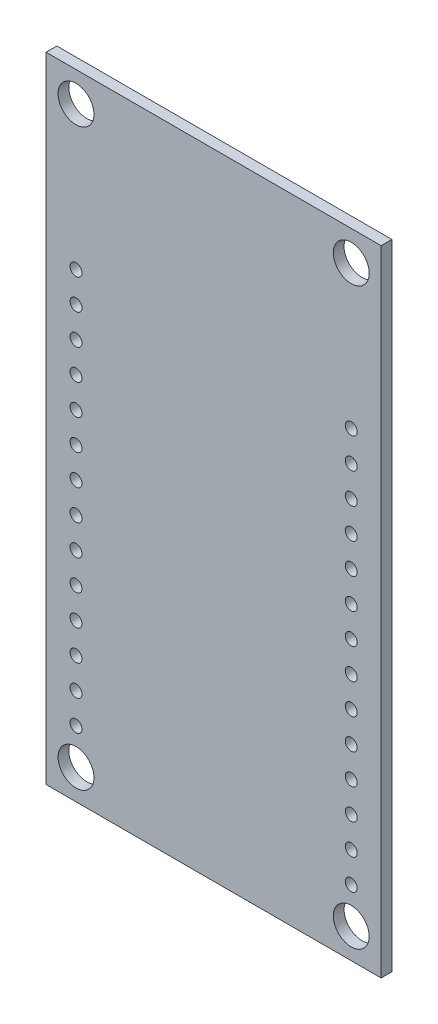
from build123d import *

# Parameters (mm, degrees)
ESBO_O1_W                = 28
ESBO_O1_H                = 53
RESSALTO_EXTRUS_O1_DEPTH = 0.45
CORTE_EXTRUS_O1_REACH    = 31.984
ESBO_O4_R                = 1.5
CORTE_EXTRUS_O2_REACH    = 31.984
ESBO_O5_R                = 0.5
PADR_O_LINEAR1_COUNT     = 14
PADR_O_LINEAR1_PITCH     = 2.54


with BuildPart() as part:
    # Esboço1 → Ressalto-extrusão1 (new, symmetric)
    with BuildSketch(Plane.XY):
        Rectangle(ESBO_O1_W, ESBO_O1_H)
    extrude(amount=RESSALTO_EXTRUS_O1_DEPTH, both=True)

    # Esboço4 → Corte-extrusão1 (cut, up to next)
    with BuildSketch(Plane.XY.offset(0.45), mode=Mode.PRIVATE) as corte_extrus_o1_sk1:
        with Locations((-11.5, -24)):
            Circle(ESBO_O4_R)
    corte_extrus_o1_tool1 = extrude(corte_extrus_o1_sk1.sketch, amount=-CORTE_EXTRUS_O1_REACH, mode=Mode.PRIVATE) & part.part
    # Esboço4 → Corte-extrusão1 (cut, up to next)
    with BuildSketch(Plane.XY.offset(0.45), mode=Mode.PRIVATE) as corte_extrus_o1_sk2:
        with Locations((11.5, -24)):
            Circle(ESBO_O4_R)
    corte_extrus_o1_tool2 = extrude(corte_extrus_o1_sk2.sketch, amount=-CORTE_EXTRUS_O1_REACH, mode=Mode.PRIVATE) & part.part
    # Esboço4 → Corte-extrusão1 (cut, up to next)
    with BuildSketch(Plane.XY.offset(0.45), mode=Mode.PRIVATE) as corte_extrus_o1_sk3:
        with Locations((11.5, 24)):
            Circle(ESBO_O4_R)
    corte_extrus_o1_tool3 = extrude(corte_extrus_o1_sk3.sketch, amount=-CORTE_EXTRUS_O1_REACH, mode=Mode.PRIVATE) & part.part
    # Esboço4 → Corte-extrusão1 (cut, up to next)
    with BuildSketch(Plane.XY.offset(0.45), mode=Mode.PRIVATE) as corte_extrus_o1_sk4:
        with Locations((-11.5, 24)):
            Circle(ESBO_O4_R)
    corte_extrus_o1_tool4 = extrude(corte_extrus_o1_sk4.sketch, amount=-CORTE_EXTRUS_O1_REACH, mode=Mode.PRIVATE) & part.part
    add(corte_extrus_o1_tool1.solids().sort_by_distance((-11.5, -24, 0.45))[0], mode=Mode.SUBTRACT)
    add(corte_extrus_o1_tool2.solids().sort_by_distance((11.5, -24, 0.45))[0], mode=Mode.SUBTRACT)
    add(corte_extrus_o1_tool3.solids().sort_by_distance((11.5, 24, 0.45))[0], mode=Mode.SUBTRACT)
    add(corte_extrus_o1_tool4.solids().sort_by_distance((-11.5, 24, 0.45))[0], mode=Mode.SUBTRACT)

    # Esboço5 → Corte-extrusão2 (cut, up to next)
    with BuildSketch(Plane.XY.offset(0.45), mode=Mode.PRIVATE) as corte_extrus_o2_sk1:
        with Locations((-11.5, -21)):
            Circle(ESBO_O5_R)
    corte_extrus_o2_tool1 = extrude(corte_extrus_o2_sk1.sketch, amount=-CORTE_EXTRUS_O2_REACH, mode=Mode.PRIVATE) & part.part
    # Esboço5 → Corte-extrusão2 (cut, up to next)
    with BuildSketch(Plane.XY.offset(0.45), mode=Mode.PRIVATE) as corte_extrus_o2_sk2:
        with Locations((11.5, -21)):
            Circle(ESBO_O5_R)
    corte_extrus_o2_tool2 = extrude(corte_extrus_o2_sk2.sketch, amount=-CORTE_EXTRUS_O2_REACH, mode=Mode.PRIVATE) & part.part
    corte_extrus_o2_1 = corte_extrus_o2_tool1.solids().sort_by_distance((-11.5, -21, 0.45))[0]
    add(corte_extrus_o2_1, mode=Mode.SUBTRACT)
    corte_extrus_o2_2 = corte_extrus_o2_tool2.solids().sort_by_distance((11.5, -21, 0.45))[0]
    add(corte_extrus_o2_2, mode=Mode.SUBTRACT)
    corte_extrus_o2 = corte_extrus_o2_1 + corte_extrus_o2_2  # Corte-extrusão2 as one shape, for the pattern or mirror that repeats it

    # Padrão linear1: Corte-extrusão2 ×14
    with Locations(*[(0, i * PADR_O_LINEAR1_PITCH, 0) for i in range(1, PADR_O_LINEAR1_COUNT)]):
        add(corte_extrus_o2, mode=Mode.SUBTRACT)


solid = part.part
